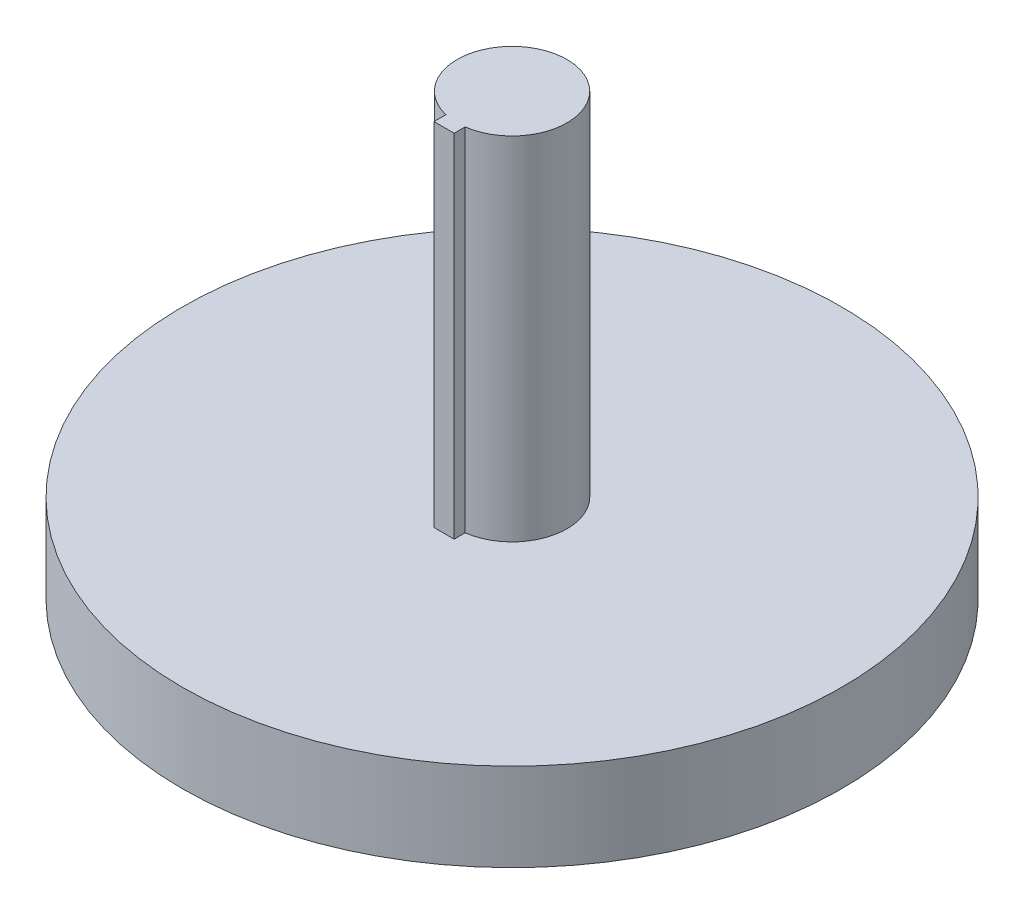
from build123d import *

# Parameters (mm, degrees)
SKETCH1_R           = 150
BOSS_EXTRUDE1_DEPTH = 40
BOSS_EXTRUDE2_DEPTH = 200


with BuildPart() as part:
    # Sketch1 → Boss-Extrude1 (new body)
    with BuildSketch(Plane(origin=(0, 0, 0), x_dir=(1, 0, 0), z_dir=(0, 1, 0))):
        Circle(SKETCH1_R)
        with BuildLine():
            Line((-5.790928426, -29.760056496), (-5.790928426, -24.320056496))
            ThreePointArc((-5.790928426, -24.320056496), (-15.49559275, 19.618527094), (25, 0))
            ThreePointArc((25, 0), (18.844452623, -16.428225873), (3.409071574, -24.766473932))
            Line((3.409071574, -24.766473932), (3.409071574, -29.760056496))
            Line((3.409071574, -29.760056496), (-5.790928426, -29.760056496))
        make_face(mode=Mode.SUBTRACT)
    extrude(amount=BOSS_EXTRUDE1_DEPTH)

    # Sketch1<3> → Boss-Extrude2 (add)
    with BuildSketch(Plane(origin=(0, 0, 0), x_dir=(1, 0, 0), z_dir=(0, 1, 0))):
        with BuildLine():
            Line((-5.790928426, -24.320056496), (-5.790928426, -29.760056496))
            Line((-5.790928426, -29.760056496), (3.409071574, -29.760056496))
            Line((3.409071574, -29.760056496), (3.409071574, -24.766473932))
            ThreePointArc((3.409071574, -24.766473932), (1.211665237, 24.970620083), (-5.790928426, -24.320056496))
        make_face()
    extrude(amount=BOSS_EXTRUDE2_DEPTH)


solid = part.part
